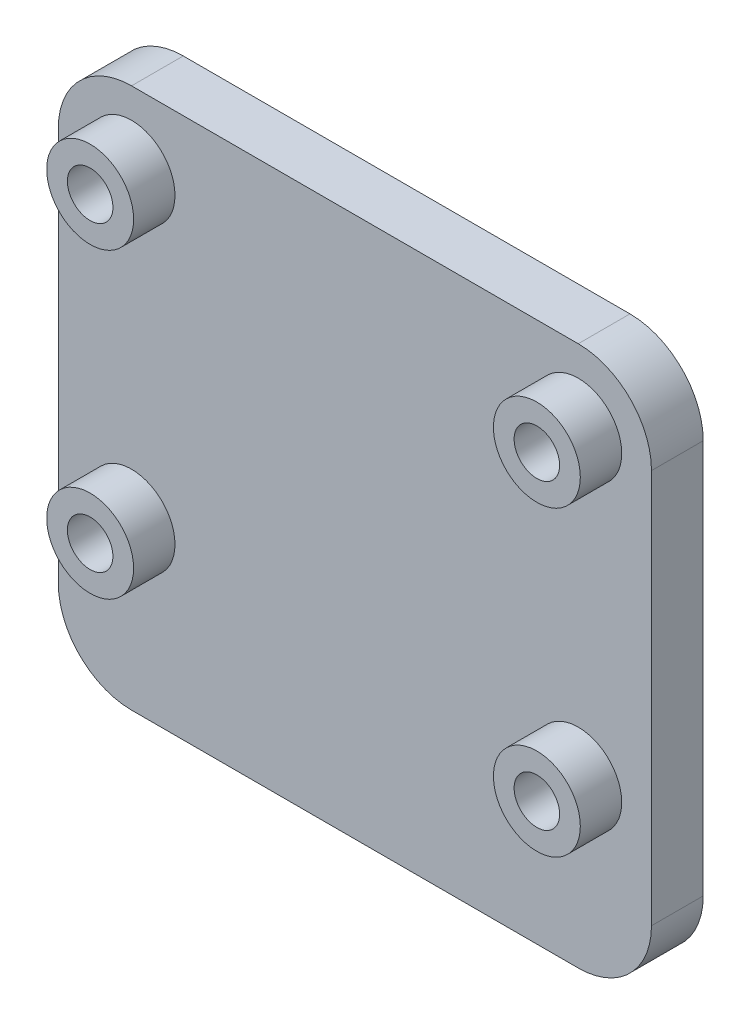
from build123d import *

# Parameters (mm, degrees)
SKETCH1_R           = 2.1
SKETCH1_R_2         = 1.1
BOSS_EXTRUDE1_DEPTH = 2.5
BOSS_EXTRUDE2_START = 2.5
SKETCH1_3_R         = 2.1
SKETCH1_3_R_2       = 1.1
BOSS_EXTRUDE2_DEPTH = 2


with BuildPart() as part:
    # Sketch1 → Boss-Extrude1 (new body)
    # profile 1 of 5: a face of its own
    with BuildSketch(Plane.XY):
        with BuildLine():
            Line((10.795, 13.065), (-10.795, 13.065))
            ThreePointArc((-10.795, 13.065), (-13.298158005, 12.028158005), (-14.335, 9.525))
            Line((-14.335, 9.525), (-14.335, -9.525))
            ThreePointArc((-14.335, -9.525), (-13.298158005, -12.028158005), (-10.795, -13.065))
            Line((-10.795, -13.065), (10.795, -13.065))
            ThreePointArc((10.795, -13.065), (13.298158005, -12.028158005), (14.335, -9.525))
            Line((14.335, -9.525), (14.335, 9.525))
            ThreePointArc((14.335, 9.525), (13.298158005, 12.028158005), (10.795, 13.065))
        make_face()
        with Locations((10.795, 9.525)):
            Circle(SKETCH1_R, mode=Mode.SUBTRACT)
        with Locations((10.795, -5.08)):
            Circle(SKETCH1_R, mode=Mode.SUBTRACT)
        with Locations((-10.795, -5.08)):
            Circle(SKETCH1_R, mode=Mode.SUBTRACT)
        with Locations((-10.795, 9.525)):
            Circle(SKETCH1_R, mode=Mode.SUBTRACT)
    # profile 2 of 5: a face of its own
    with BuildSketch(Plane.XY):
        with Locations((-10.795, -5.08)):
            Circle(SKETCH1_R)
        with Locations((-10.795, -5.08)):
            Circle(SKETCH1_R_2, mode=Mode.SUBTRACT)
    # profile 3 of 5: a face of its own
    with BuildSketch(Plane.XY):
        with Locations((-10.795, 9.525)):
            Circle(SKETCH1_R)
        with Locations((-10.795, 9.525)):
            Circle(SKETCH1_R_2, mode=Mode.SUBTRACT)
    # profile 4 of 5: a face of its own
    with BuildSketch(Plane.XY):
        with Locations((10.795, 9.525)):
            Circle(SKETCH1_R)
        with Locations((10.795, 9.525)):
            Circle(SKETCH1_R_2, mode=Mode.SUBTRACT)
    # profile 5 of 5: a face of its own
    with BuildSketch(Plane.XY):
        with Locations((10.795, -5.08)):
            Circle(SKETCH1_R)
        with Locations((10.795, -5.08)):
            Circle(SKETCH1_R_2, mode=Mode.SUBTRACT)
    extrude(amount=BOSS_EXTRUDE1_DEPTH)

    # Sketch1<3> → Boss-Extrude2 (add)
    # profile 1 of 4: a face of its own
    with BuildSketch(Plane.XY.offset(BOSS_EXTRUDE2_START)):
        with Locations((-10.795, 9.525)):
            Circle(SKETCH1_3_R)
        with Locations((-10.795, 9.525)):
            Circle(SKETCH1_3_R_2, mode=Mode.SUBTRACT)
    # profile 2 of 4: a face of its own
    with BuildSketch(Plane.XY.offset(BOSS_EXTRUDE2_START)):
        with Locations((10.795, 9.525)):
            Circle(SKETCH1_3_R)
        with Locations((10.795, 9.525)):
            Circle(SKETCH1_3_R_2, mode=Mode.SUBTRACT)
    # profile 3 of 4: a face of its own
    with BuildSketch(Plane.XY.offset(BOSS_EXTRUDE2_START)):
        with Locations((10.795, -5.08)):
            Circle(SKETCH1_3_R)
        with Locations((10.795, -5.08)):
            Circle(SKETCH1_3_R_2, mode=Mode.SUBTRACT)
    # profile 4 of 4: a face of its own
    with BuildSketch(Plane.XY.offset(BOSS_EXTRUDE2_START)):
        with Locations((-10.795, -5.08)):
            Circle(SKETCH1_3_R)
        with Locations((-10.795, -5.08)):
            Circle(SKETCH1_3_R_2, mode=Mode.SUBTRACT)
    extrude(amount=BOSS_EXTRUDE2_DEPTH)


solid = part.part
